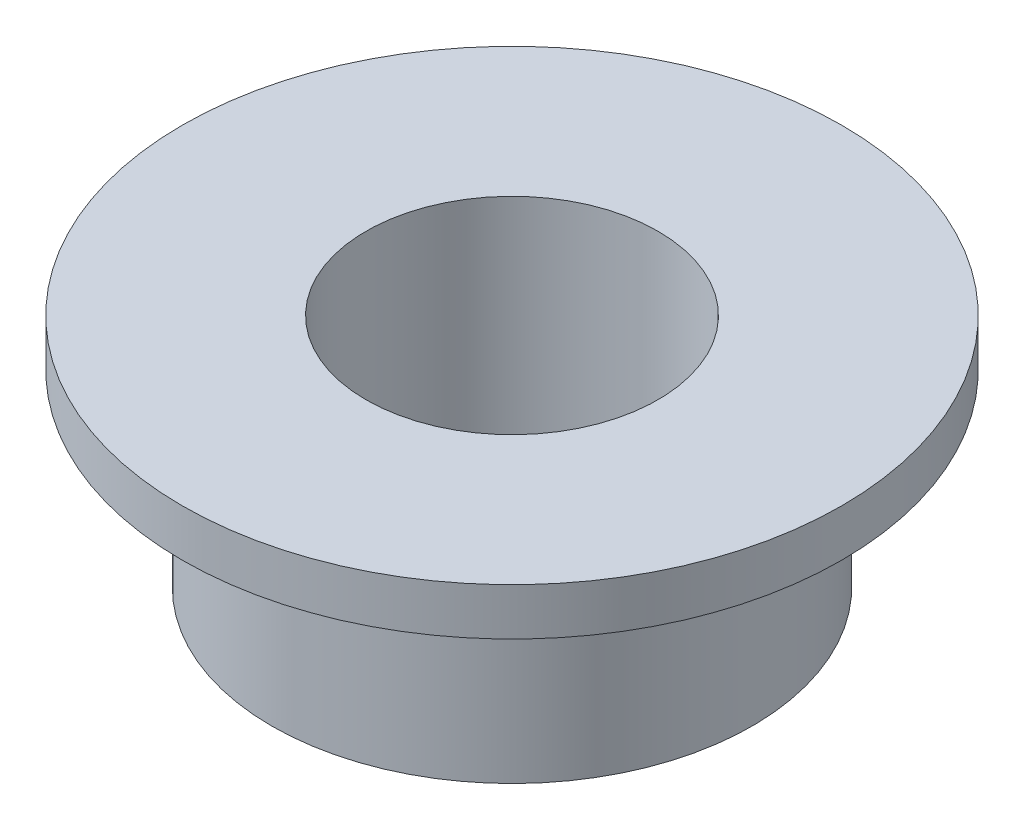
from build123d import *

# Parameters (mm, degrees)
SKETCH1_R           = 12.75
SKETCH1_R_2         = 7.75
BOSS_EXTRUDE1_DEPTH = 5
SKETCH2_R           = 17.5
SKETCH2_R_2         = 7.75
BOSS_EXTRUDE2_DEPTH = 2.5


with BuildPart() as part:
    # Sketch1 → Boss-Extrude1 (new, symmetric)
    with BuildSketch(Plane(origin=(0, 0, 0), x_dir=(1, 0, 0), z_dir=(0, 1, 0))):
        with Locations(Location((0, 0, 0), (0, 0, 270))):
            Circle(SKETCH1_R)
        with Locations(Location((0, 0, 0), (0, 0, 270))):
            Circle(SKETCH1_R_2, mode=Mode.SUBTRACT)
    extrude(amount=BOSS_EXTRUDE1_DEPTH, both=True)

    # Sketch2 → Boss-Extrude2 (add)
    with BuildSketch(Plane(origin=(0, 5, 0), x_dir=(1, 0, 0), z_dir=(0, 1, 0))):
        with Locations(Location((0, 0, 0), (0, 0, 270))):
            Circle(SKETCH2_R)
        with Locations(Location((0, 0, 0), (0, 0, 270))):
            Circle(SKETCH2_R_2, mode=Mode.SUBTRACT)
    extrude(amount=BOSS_EXTRUDE2_DEPTH)


solid = part.part
